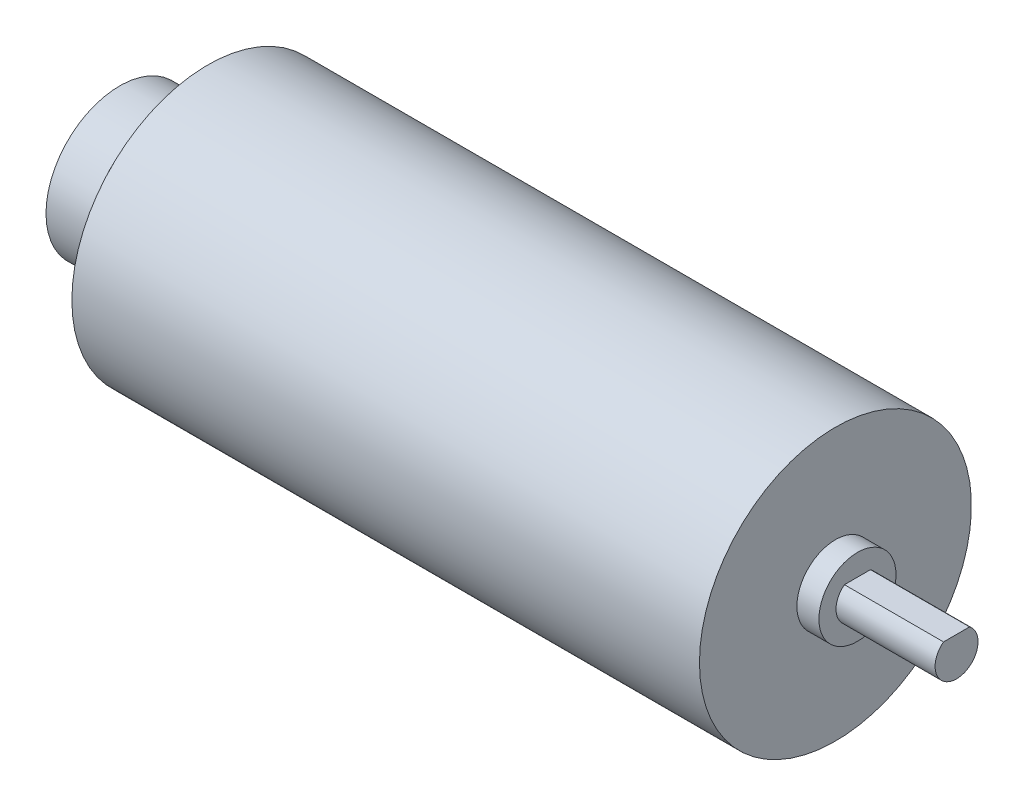
from build123d import *

# Parameters (mm, degrees)
SKETCH_1_W      = 57
SKETCH_1_H      = 12.35
SKETCH_2_R      = 3.5
EXTRUDE_1_DEPTH = 2
SKETCH_5_R      = 0.75
EXTRUDE_3_DEPTH = 4
SKETCH_6_R      = 6.7
EXTRUDE_4_DEPTH = 4
EXTRUDE_5_DEPTH = 9


with BuildPart() as part:
    # Эскиз1 → Повернуть1 (revolve)
    with BuildSketch(Plane(origin=(0, 0, 0), x_dir=(1, 0, 0), z_dir=(0, 1, 0)), mode=Mode.PRIVATE) as revolve_1_sk:
        with Locations((0, 6.175)):
            Rectangle(SKETCH_1_W, SKETCH_1_H)
    revolve(revolve_1_sk.sketch.rotate(Axis((-28.5, 0, 0), (1, 0, 0)), 180), axis=Axis((-28.5, 0, 0), (1, 0, 0)))

    # Эскиз2 → Бобышка-Вытянуть1 (add)
    with BuildSketch(Plane(origin=(28.5, 0, 0), x_dir=(0, 0, -1), z_dir=(1, 0, 0))):
        with Locations(Location((0, 0, 0), (0, 0, 180))):
            Circle(SKETCH_2_R)
    extrude(amount=EXTRUDE_1_DEPTH)

    # Эскиз5 → Бобышка-Вытянуть3 (add)
    with BuildSketch(Plane.ZY.offset(28.5)):
        with Locations(Location((0, 0, 0), (0, 0, 180))):
            Circle(SKETCH_5_R)
    extrude(amount=EXTRUDE_3_DEPTH)

    # Эскиз6 → Бобышка-Вытянуть4 (add)
    with BuildSketch(Plane.ZY.offset(32.5)):
        Circle(SKETCH_6_R)
    extrude(amount=EXTRUDE_4_DEPTH)

    # Эскиз3 → Бобышка-Вытянуть5 (add)
    with BuildSketch(Plane(origin=(30.5, 0, 0), x_dir=(0, 0, -1), z_dir=(1, 0, 0))):
        with BuildLine():
            Line((1.183215957, 1.55), (-1.183215957, 1.55))
            ThreePointArc((-1.183215957, 1.55), (-0.864647004, -1.747823091), (1.95, 0))
            ThreePointArc((1.95, 0), (1.747823091, 0.864647004), (1.183215957, 1.55))
        make_face()
    extrude(amount=EXTRUDE_5_DEPTH)


solid = part.part
